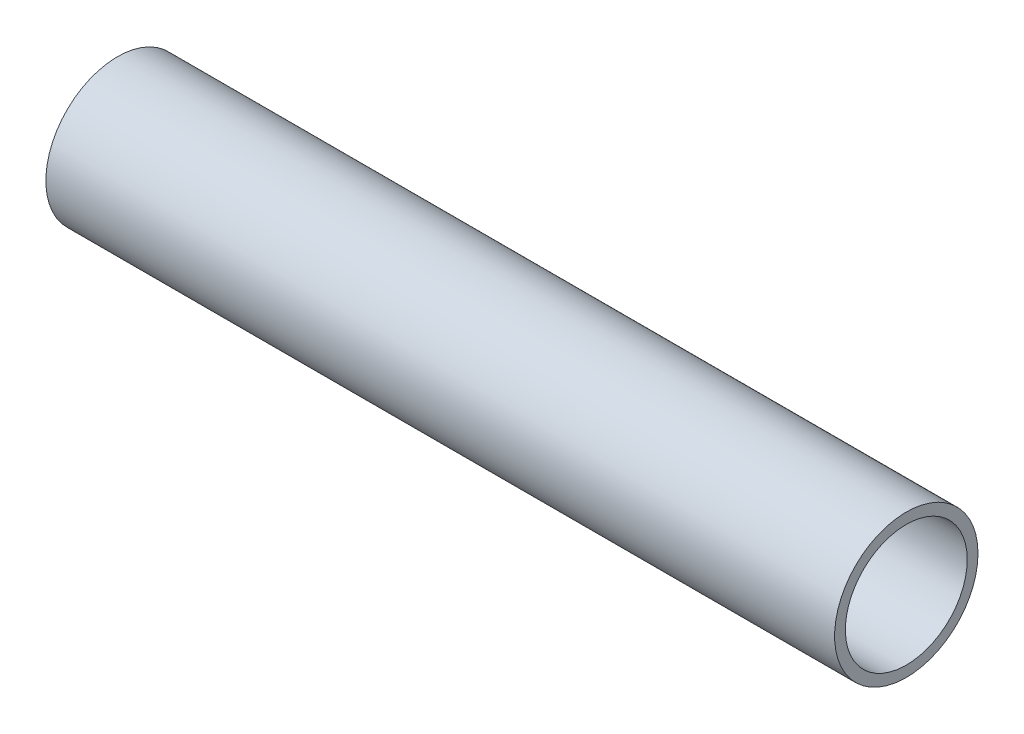
from build123d import *

# Parameters (mm, degrees)
SKETCH_1_R      = 10
SKETCH_1_R_2    = 8.5
EXTRUDE_1_DEPTH = 110


with BuildPart() as part:
    # 草图1 → 凸台-拉伸1 (new body)
    with BuildSketch(Plane(origin=(0, 0, 0), x_dir=(0, 0, -1), z_dir=(1, 0, 0))):
        Circle(SKETCH_1_R)
        Circle(SKETCH_1_R_2, mode=Mode.SUBTRACT)
    extrude(amount=EXTRUDE_1_DEPTH)


solid = part.part
